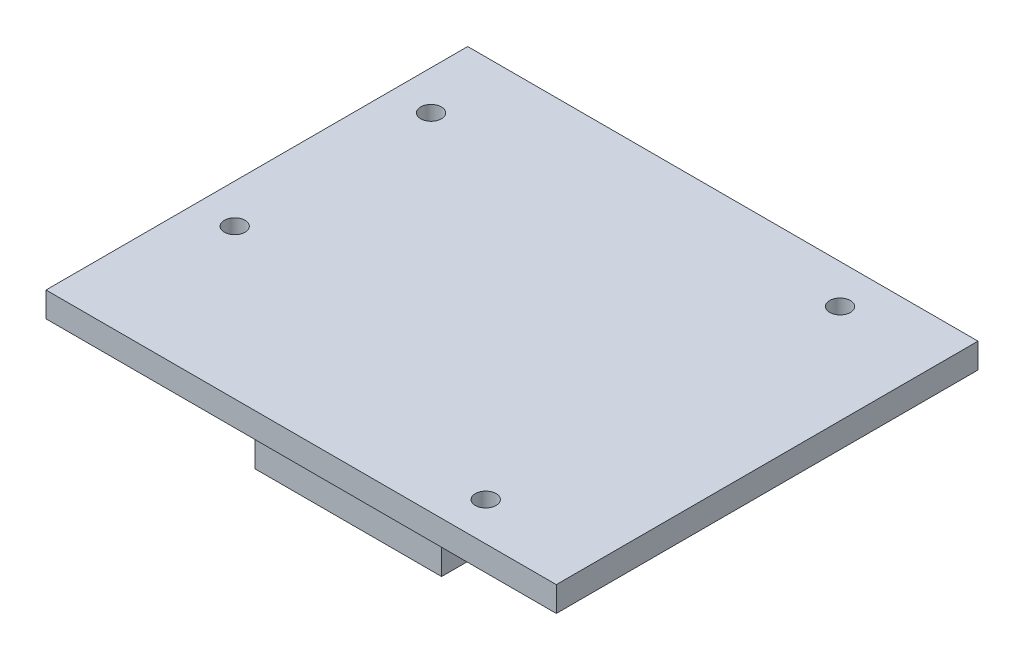
from build123d import *

# Parameters (mm, degrees)
SKETCH_1_W               = 71.4
SKETCH_1_H               = 59
EXTRUDE_1_DEPTH          = 3.5
CUT_EXTRUDE_4_DEPTH      = 8.5
CUT_EXTRUDE_4_DEPTH_BACK = 15
SKETCH_2_R               = 1.45
SKETCH_5_W               = 26.11
SKETCH_5_H               = 45.8
EXTRUDE_2_DEPTH          = 10.15
SKETCH_6_W               = 20
SKETCH_6_H               = 39.55
CUT_EXTRUDE_5_DEPTH      = 10.15


with BuildPart() as part:
    # 草圖1 → 填料-伸長1 (new body)
    with BuildSketch(Plane(origin=(0, 0, 0), x_dir=(1, 0, 0), z_dir=(0, 1, 0))):
        Rectangle(SKETCH_1_W, SKETCH_1_H)
    extrude(amount=-EXTRUDE_1_DEPTH)

    # 草圖2 → 除料-伸長4 (cut, two sides: drawn at the far end of the back side and taken through both)
    with BuildSketch(Plane(origin=(0, 0, 0), x_dir=(1, 0, 0), z_dir=(0, 1, 0)).offset(-CUT_EXTRUDE_4_DEPTH_BACK)):
        with Locations(Location((20.453418067, -24.130543915, 0), (0, 0, 270))):
            Circle(SKETCH_2_R)
        with Locations(Location((-30.223577589, 18.9, 0), (0, 0, 270))):
            Circle(SKETCH_2_R)
        with Locations(Location((-30.223577589, -8.577967438, 0), (0, 0, 270))):
            Circle(SKETCH_2_R)
        with Locations(Location((21.85, 24.05, 0), (0, 0, 270))):
            Circle(SKETCH_2_R)
    extrude(amount=CUT_EXTRUDE_4_DEPTH + CUT_EXTRUDE_4_DEPTH_BACK, mode=Mode.SUBTRACT)

    # 草圖5 → 填料-伸長2 (add)
    with BuildSketch(Plane(origin=(0, -3.5, 0), x_dir=(-1, 0, 0), z_dir=(0, -1, 0))):
        Rectangle(SKETCH_5_W, SKETCH_5_H)
    extrude(amount=EXTRUDE_2_DEPTH)

    # 草圖6 → 除料-伸長5 (cut)
    with BuildSketch(Plane.XZ.offset(13.65)):
        Rectangle(SKETCH_6_W, SKETCH_6_H)
    extrude(amount=-CUT_EXTRUDE_5_DEPTH, mode=Mode.SUBTRACT)


solid = part.part
